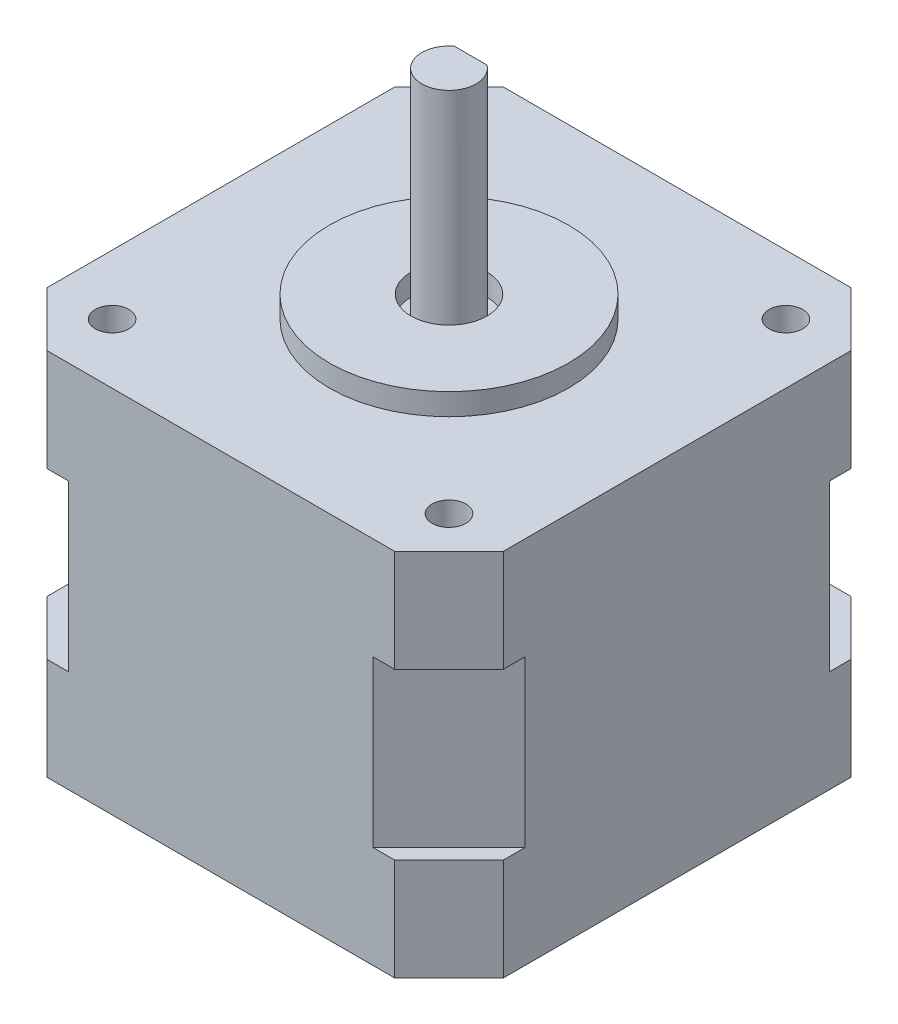
from build123d import *

# Parameters (mm, degrees)
SKETCH4_W               = 42
SKETCH4_H               = 42
BOTTOM_DEPTH            = 9.4
MIDDLE_DEPTH            = 15.2
SKETCH8_W               = 42
SKETCH8_H               = 42
TOP_DEPTH               = 9.4
CHAMFER1_SIZE           = 5
SKETCH9_R               = 11
SKETCH9_R_2             = 3.5
RING_DEPTH              = 2
SKETCH10_R              = 2.5
SHAFT_DEPTH             = 20
SKETCH12_R              = 1.55
CUT_EXTRUDE4_DEPTH      = 4.5
CUT_EXTRUDE5_START      = -10
SKETCH15_R              = 1.55
CUT_EXTRUDE5_DEPTH      = 10
BOSS_EXTRUDE1_START     = 10
SKETCH16_R              = 2.5
BOSS_EXTRUDE1_DEPTH     = 10
CUT_EXTRUDE3_DEPTH      = 5
CUT_EXTRUDE3_DEPTH_BACK = 5
SKETCH11_W              = 1.458446266
SKETCH11_H              = 24.242457261
SKETCH11_W_2            = 8.851647276
SKETCH11_H_2            = 12.03282496


with BuildPart() as part:
    # Sketch4 → Bottom (new body)
    with BuildSketch(Plane(origin=(0, 0, 0), x_dir=(1, 0, 0), z_dir=(0, 1, 0))):
        Rectangle(SKETCH4_W, SKETCH4_H)
    extrude(amount=BOTTOM_DEPTH)

    # Sketch6 → Middle (add)
    with BuildSketch(Plane(origin=(0, 9.4, 0), x_dir=(1, 0, 0), z_dir=(0, 1, 0))):
        Polygon((-21, -14), (-14, -21), (14, -21), (21, -14), (21, 14), (14, 21), (-14, 21), (-21, 14), align=None)
    extrude(amount=MIDDLE_DEPTH)

    # Sketch8 → Top (add)
    with BuildSketch(Plane(origin=(0, 24.6, 0), x_dir=(1, 0, 0), z_dir=(0, 1, 0))):
        Rectangle(SKETCH8_W, SKETCH8_H)
    extrude(amount=TOP_DEPTH)

    # Chamfer1
    chamfer1_edges = [part.edges().sort_by_distance(p)[0] for p in [
        (21, 29.3, 21),
        (21, 29.3, -21),
        (-21, 29.3, -21),
        (-21, 29.3, 21),
        (-21, 4.7, 21),
        (-21, 4.7, -21),
        (21, 4.7, -21),
        (21, 4.7, 21),
    ]]
    chamfer(chamfer1_edges, length=CHAMFER1_SIZE)

    # Sketch9 → Ring (add)
    with BuildSketch(Plane(origin=(0, 34, 0), x_dir=(1, 0, 0), z_dir=(0, 1, 0))):
        with Locations(Location((0, 0, 0), (0, 0, 270))):
            Circle(SKETCH9_R)
        with Locations(Location((0, 0, 0), (0, 0, 270))):
            Circle(SKETCH9_R_2, mode=Mode.SUBTRACT)
    extrude(amount=RING_DEPTH)

    # Sketch10 → Shaft (add)
    with BuildSketch(Plane(origin=(0, 34, 0), x_dir=(1, 0, 0), z_dir=(0, 1, 0))):
        with Locations(Location((0, 0, 0), (0, 0, 90))):
            Circle(SKETCH10_R)
    extrude(amount=SHAFT_DEPTH)

    # Sketch12 → Cut-Extrude4 (cut)
    with BuildSketch(Plane(origin=(0, 34, 0), x_dir=(1, 0, 0), z_dir=(0, 1, 0))):
        with Locations(Location((15.5, -15.5, 0), (0, 0, 270))):
            Circle(SKETCH12_R)
        with Locations(Location((-15.5, -15.5, 0), (0, 0, 270))):
            Circle(SKETCH12_R)
        with Locations(Location((-15.5, 15.5, 0), (0, 0, 270))):
            Circle(SKETCH12_R)
        with Locations(Location((15.5, 15.5, 0), (0, 0, 270))):
            Circle(SKETCH12_R)
    extrude(amount=-CUT_EXTRUDE4_DEPTH, mode=Mode.SUBTRACT)

    # Sketch15 → Cut-Extrude5 (cut)
    with BuildSketch(Plane.XZ.offset(CUT_EXTRUDE5_START)):
        with Locations(Location((15.5, 15.5, 0), (0, 0, 90))):
            Circle(SKETCH15_R)
        with Locations(Location((15.5, -15.5, 0), (0, 0, 90))):
            Circle(SKETCH15_R)
        with Locations(Location((-15.5, 15.5, 0), (0, 0, 90))):
            Circle(SKETCH15_R)
        with Locations(Location((-15.5, -15.5, 0), (0, 0, 90))):
            Circle(SKETCH15_R)
    extrude(amount=CUT_EXTRUDE5_DEPTH, mode=Mode.SUBTRACT)

    # Sketch16 → Boss-Extrude1 (add)
    with BuildSketch(Plane(origin=(0, 0, 0), x_dir=(-1, 0, 0), z_dir=(0, -1, 0)).offset(BOSS_EXTRUDE1_START)):
        with Locations(Location((0, 0, 0), (0, 0, 90))):
            Circle(SKETCH16_R)
    extrude(amount=-BOSS_EXTRUDE1_DEPTH)

    # Sketch11 → Cut-Extrude3 (cut, two sides: drawn at the far end of the back side and taken through both)
    with BuildSketch(Plane(origin=(0, 0, 0), x_dir=(0, 0, -1), z_dir=(1, 0, 0)).offset(-CUT_EXTRUDE3_DEPTH_BACK)):
        with Locations((2.729223133, 51.12122863)):
            Rectangle(SKETCH11_W, SKETCH11_H)
        with Locations((6.425823638, -7.01641248)):
            Rectangle(SKETCH11_W_2, SKETCH11_H_2)
    extrude(amount=CUT_EXTRUDE3_DEPTH + CUT_EXTRUDE3_DEPTH_BACK, mode=Mode.SUBTRACT)


solid = part.part
